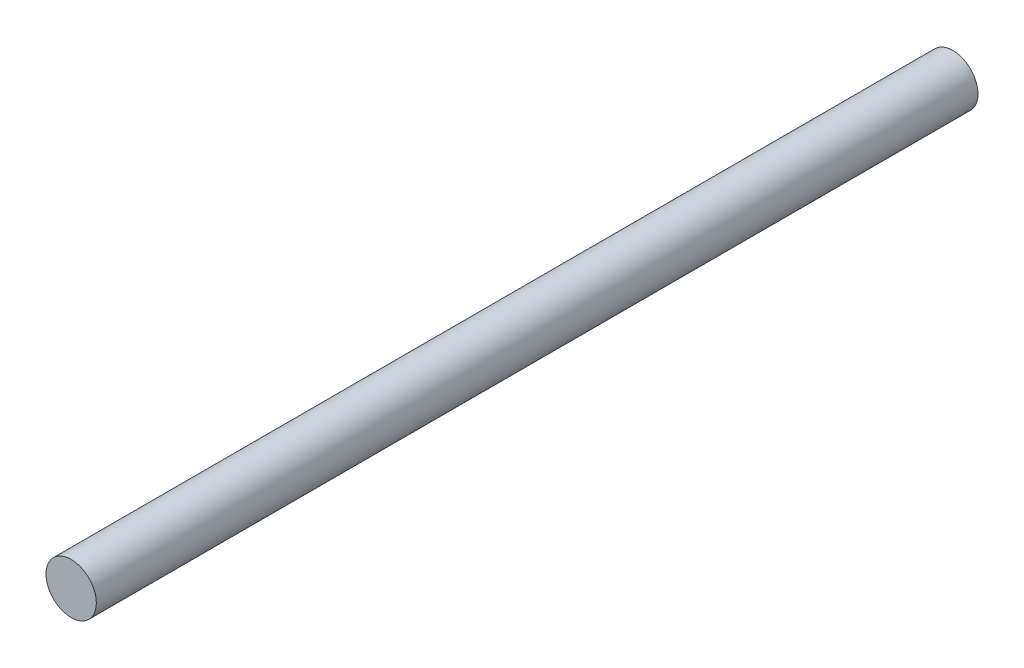
from build123d import *

# Parameters (mm, degrees)
ESQUISSE1_R        = 4
BOSS_EXTRU_1_DEPTH = 140


with BuildPart() as part:
    # Esquisse1 → Boss.-Extru.1 (new body)
    with BuildSketch(Plane.XY):
        Circle(ESQUISSE1_R)
    extrude(amount=BOSS_EXTRU_1_DEPTH)


solid = part.part
